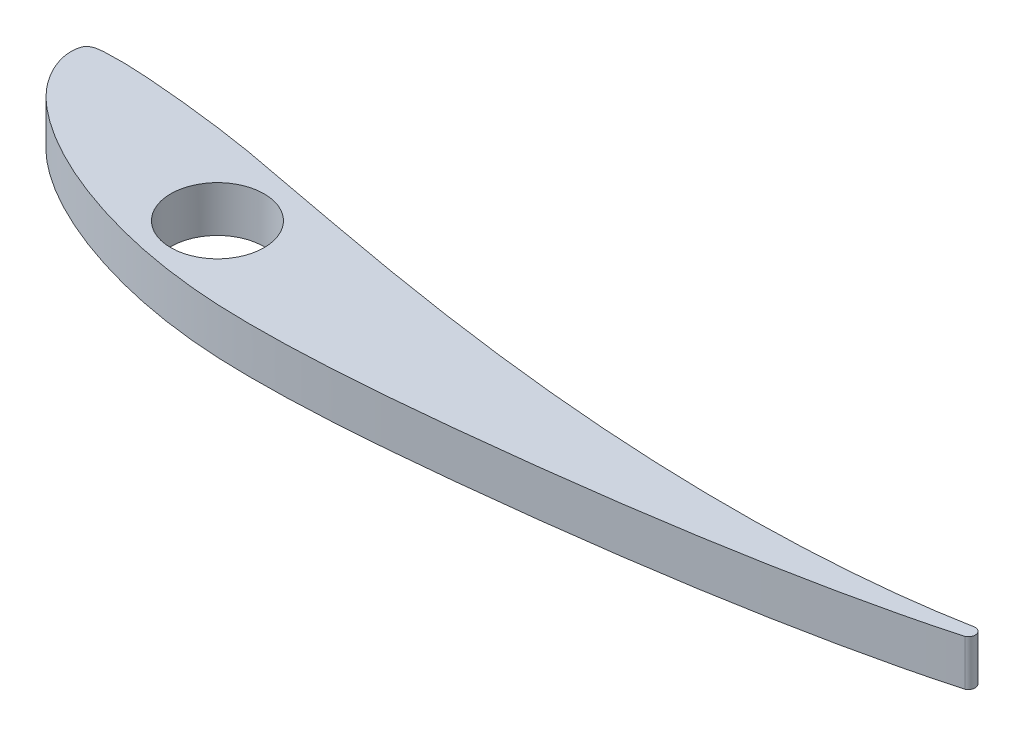
from build123d import *

# Parameters (mm, degrees)
BOSS_EXTRUDE1_DEPTH      = 3.175
BOSS_EXTRUDE1_DEPTH_BACK = 3.175
CUT_EXTRUDE2_DEPTH       = 152.504993052
CUT_EXTRUDE2_DEPTH_BACK  = 152.504993052
SKETCH3_R                = 6.477
CUT_EXTRUDE3_DEPTH       = 152.504993052
CUT_EXTRUDE3_DEPTH_BACK  = 152.504993052


with BuildPart() as part:
    # Sketch1 → Boss-Extrude1 (new, two sides: drawn at the far end of the back side and taken through both)
    with BuildSketch(Plane(origin=(0, 0, 0), x_dir=(1, 0, 0), z_dir=(0, 1, 0)).offset(-BOSS_EXTRUDE1_DEPTH_BACK)):
        with BuildLine():
            add(Edge.make_bspline(
                [(150, 0), (149.999082428, 0.00389582), (149.419672053, -0.389722724), (148.777054722, -0.778630867), (147.10425347, -1.783608513), (144.835255918, -2.870659693), (141.654931001, -4.058768874), (137.768772177, -5.172286572), (133.222466898, -6.213228852), (128.099790299, -7.129925146), (122.460796636, -7.891712549), (116.378899618, -8.47651792), (109.926502557, -8.861949019), (103.181194498, -9.043034696), (96.220212479, -9.015563475), (89.12121774, -8.781537996), (81.961225488, -8.353867109), (74.815043572, -7.749542113), (67.754389033, -6.98433614), (60.84596827, -6.092687983), (54.151912971, -5.10060815), (47.729921804, -4.044554377), (41.629826364, -2.959847737), (35.896437262, -1.887259389), (30.565779247, -0.87137858), (25.663915288, 0.062060314), (21.166377749, 0.806236455), (17.051277595, 1.338376169), (13.320593128, 1.753158027), (9.992512373, 2.059516322), (7.101092135, 2.250496961), (4.678500519, 2.354128591), (2.752146356, 2.285712507), (1.343995906, 2.215322014), (0.296818428, 1.716691682), (0.015403473, 0.712842885), (-0.032035919, -0.381585184), (0.216127101, -1.675493179), (0.736478586, -3.077257538), (1.548148665, -4.553558888), (2.64680221, -6.07094315), (4.07694345, -7.582573991), (5.831765897, -9.075358736), (7.885834611, -10.565607603), (10.238291416, -12.021718271), (12.874380162, -13.423953282), (15.779756793, -14.756361132), (18.945096058, -15.991873011), (22.350728531, -17.123870434), (25.982162907, -18.12585917), (29.824029484, -18.980075612), (33.872365271, -19.639079334), (38.128147898, -20.104651311), (42.608686172, -20.333578775), (47.315722089, -20.344413104), (52.2405057, -20.225708001), (57.357799405, -19.952994499), (62.63914418, -19.557277599), (68.054377517, -19.059619846), (73.565421497, -18.487940308), (79.127380563, -17.852918563), (84.694213673, -17.170545382), (90.221414687, -16.436018088), (95.668949043, -15.65169482), (101.001904957, -14.823788108), (106.185791669, -13.95069676), (111.190736162, -13.04365081), (115.985219841, -12.103954556), (120.54122319, -11.14316085), (124.830924819, -10.16621042), (128.828757145, -9.179204869), (132.511800064, -8.189287012), (135.859718648, -7.205541542), (138.853765182, -6.232586734), (141.478397693, -5.278866555), (143.721372274, -4.351116162), (145.57927393, -3.462244043), (147.073285763, -2.545188031), (148.165385918, -1.635644887), (149.091049021, -0.7806922), (149.507930169, -0.371377778), (150.000899289, -0.003818197), (150, 0)],
                knots=[0, 0, 0, 0, 0.000999594, 0.004147435, 0.009748209, 0.018044377, 0.028864178, 0.04183079, 0.056713807, 0.073341232, 0.091507989, 0.111021837, 0.131661709, 0.153207715, 0.175433402, 0.198110317, 0.221011446, 0.243905882, 0.266573311, 0.288810349, 0.310405036, 0.331177743, 0.350943876, 0.3695564, 0.386864963, 0.402753039, 0.417195876, 0.430379519, 0.442362633, 0.453032156, 0.462284346, 0.470026206, 0.476176645, 0.480649947, 0.483553073, 0.486420689, 0.489953231, 0.494096927, 0.498850588, 0.50419675, 0.510125492, 0.516691031, 0.524011699, 0.532092122, 0.540897921, 0.550403414, 0.560581041, 0.571396483, 0.582828081, 0.594829641, 0.607347037, 0.620384325, 0.633968937, 0.648199967, 0.663193937, 0.678898581, 0.695226562, 0.712113221, 0.729459406, 0.747143117, 0.765009772, 0.782904928, 0.800688045, 0.818242105, 0.835449083, 0.852211621, 0.868429578, 0.884009363, 0.898854951, 0.912881827, 0.92601075, 0.938166771, 0.949289699, 0.959322172, 0.968216949, 0.97594822, 0.982474409, 0.987904723, 0.992516501, 0.996351138, 0.999020322, 1, 1, 1, 1], degree=3))
        make_face()
    extrude(amount=BOSS_EXTRUDE1_DEPTH + BOSS_EXTRUDE1_DEPTH_BACK)

    # Sketch3 → Cut-Extrude2 (cut, two sides: drawn at the far end of the back side and taken through both)
    with BuildSketch(Plane(origin=(0, 3.175, 0), x_dir=(1, 0, 0), z_dir=(0, 1, 0)).offset(-CUT_EXTRUDE2_DEPTH_BACK)):
        with Locations((30.48, -10.16)):
            Circle(SKETCH3_R)
    extrude(amount=CUT_EXTRUDE2_DEPTH + CUT_EXTRUDE2_DEPTH_BACK, mode=Mode.SUBTRACT)

    # Sketch5 → Cut-Extrude3 (cut, two sides: drawn at the far end of the back side and taken through both)
    with BuildSketch(Plane(origin=(0, 3.175, 0), x_dir=(1, 0, 0), z_dir=(0, 1, 0)).offset(-CUT_EXTRUDE3_DEPTH_BACK)):
        with BuildLine():
            Line((132.233952939, -8.252406008), (157.140032715, -4.123325284))
            Line((157.140032715, -4.123325284), (151.419739106, 7.396162535))
            Line((151.419739106, 7.396162535), (131.469643278, -6.51404613))
            ThreePointArc((131.469643278, -6.51404613), (132.720978048, -7.001071239), (132.233952939, -8.252406008))
        make_face()
    extrude(amount=CUT_EXTRUDE3_DEPTH + CUT_EXTRUDE3_DEPTH_BACK, mode=Mode.SUBTRACT)


solid = part.part
